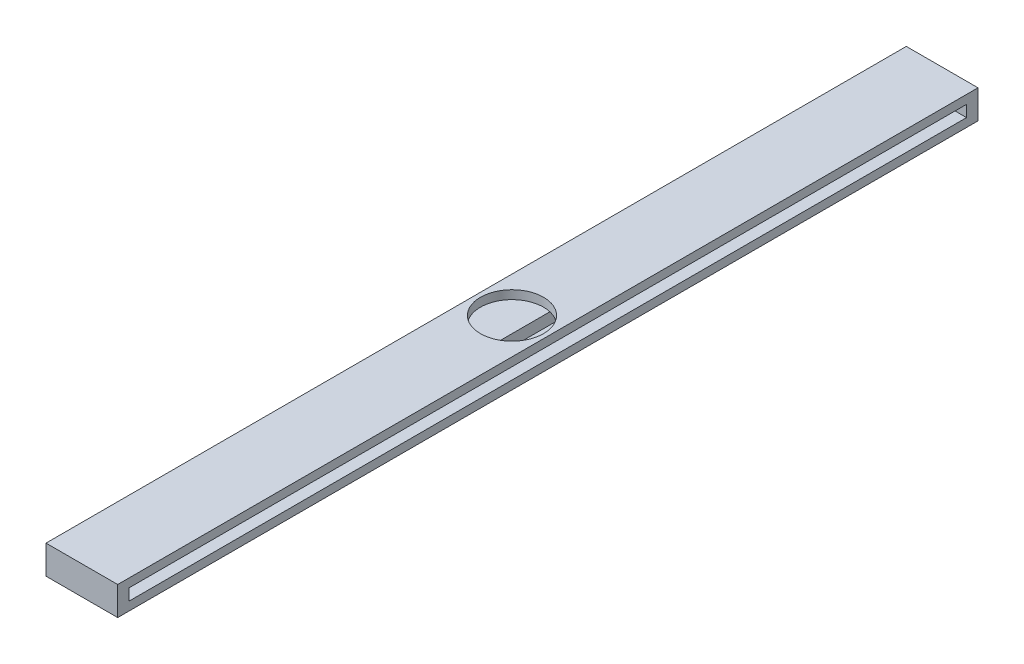
from build123d import *

# Parameters (mm, degrees)
SKETCH_1_W          = 15
SKETCH_1_H          = 300
EXTRUDE_1_DEPTH     = 4
SKETCH_2_W          = 4
SKETCH_2_H          = 4
EXTRUDE_2_DEPTH     = 10
SKETCH_3_W          = 25
SKETCH_3_H          = 300
EXTRUDE_3_DEPTH     = 3
SKETCH_4_W          = 25
SKETCH_4_H          = 300
EXTRUDE_4_DEPTH     = 3
SKETCH_5_R          = 11
CUT_EXTRUDE_1_DEPTH = 3


with BuildPart() as part:
    # 草图1 → 凸台-拉伸1 (new body)
    with BuildSketch(Plane(origin=(0, 0, 0), x_dir=(1, 0, 0), z_dir=(0, 1, 0))):
        with Locations((-54.836215811, -65.70889057)):
            Rectangle(SKETCH_1_W, SKETCH_1_H)
    extrude(amount=EXTRUDE_1_DEPTH)

    # 草图2 → 凸台-拉伸2 (add)
    with BuildSketch(Plane(origin=(-47.336215811, 0, 0), x_dir=(0, 0, -1), z_dir=(1, 0, 0))):
        with Locations((-213.70889057, 2)):
            Rectangle(SKETCH_2_W, SKETCH_2_H)
        with Locations((82.29110943, 2)):
            Rectangle(SKETCH_2_W, SKETCH_2_H)
    extrude(amount=EXTRUDE_2_DEPTH)

    # 草图3 → 凸台-拉伸3 (add)
    with BuildSketch(Plane(origin=(0, 4, 0), x_dir=(1, 0, 0), z_dir=(0, 1, 0))):
        with Locations((-49.836215811, -65.70889057)):
            Rectangle(SKETCH_3_W, SKETCH_3_H)
    extrude(amount=EXTRUDE_3_DEPTH)

    # 草图4 → 凸台-拉伸4 (add)
    with BuildSketch(Plane.XZ):
        with Locations((-49.836215811, 65.70889057)):
            Rectangle(SKETCH_4_W, SKETCH_4_H)
    extrude(amount=EXTRUDE_4_DEPTH)

    # 草图5 → 切除-拉伸1 (cut)
    with BuildSketch(Plane(origin=(0, 7, 0), x_dir=(1, 0, 0), z_dir=(0, 1, 0))):
        with Locations(Location((-49.836215811, -65.70889057, 0), (0, 0, 270))):
            Circle(SKETCH_5_R)
    extrude(amount=-CUT_EXTRUDE_1_DEPTH, mode=Mode.SUBTRACT)


solid = part.part
